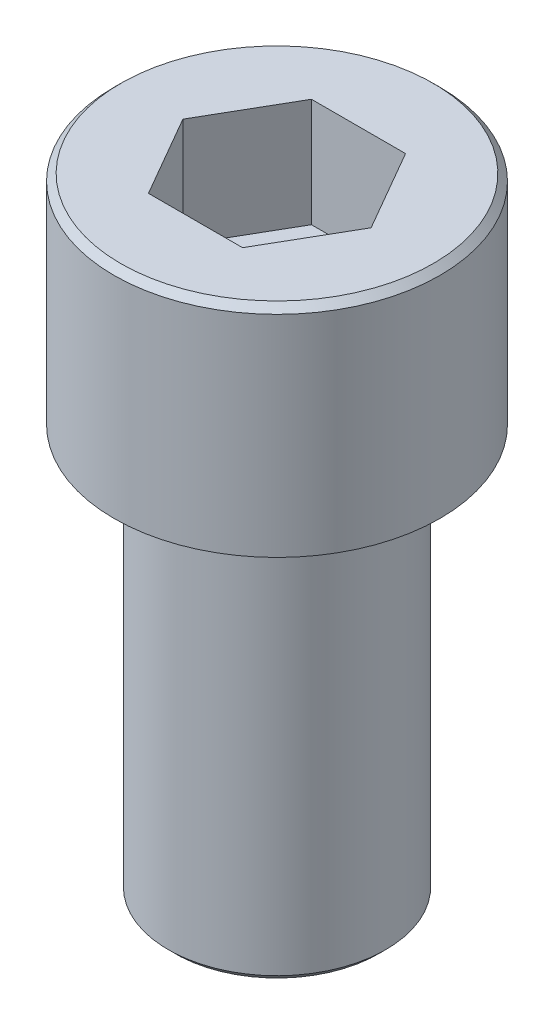
from build123d import *

# Parameters (mm, degrees)
CUT_EXTRUDE1_DEPTH = 8
CHAMFER1_SIZE      = 0.5
CUT_EXTRUDE2_DEPTH = 0.1


with BuildPart() as part:
    # Sketch1 → Base-Revolve (revolve)
    with BuildSketch(Plane.XY, mode=Mode.PRIVATE) as base_revolve_sk:
        Polygon((0, 0), (8, 0), (8, 30), (12, 30), (12, 46), (0, 46), align=None)
    revolve(base_revolve_sk.sketch.rotate(Axis((0, 0, 0), (0, 1, 0)), 90), axis=Axis((0, 0, 0), (0, 1, 0)))

    # Sketch2 → Cut-Extrude1 (cut)
    with BuildSketch(Plane(origin=(0, 46, 0), x_dir=(-1, 0, 0), z_dir=(0, 1, 0))):
        Polygon((3.464101615, -6), (-3.464101615, -6), (-6.92820323, 0), (-3.464101615, 6), (3.464101615, 6), (6.92820323, 0), align=None)
    extrude(amount=-CUT_EXTRUDE1_DEPTH, mode=Mode.SUBTRACT)

    # Chamfer1
    chamfer1_edges = [part.edges().sort_by_distance(p)[0] for p in [
        (0, 46, 12),
        (0, 0, 8),
    ]]
    chamfer(chamfer1_edges, length=CHAMFER1_SIZE)

    # Sketch3 → Cut-Extrude2 (cut)
    # profile 1 of 4: a face of its own
    with BuildSketch(Plane(origin=(0, 38, 0), x_dir=(1, 0, 0), z_dir=(0, 1, 0))):
        Polygon((-3.202624199, -0.5), (-2.740384615, -0.5), (-2.740384615, -3), (-2.96474359, -3), (-2.96474359, -0.756410256), (-3.349358974, -0.756410256), align=None)
    # profile 2 of 4: a face of its own
    with BuildSketch(Plane(origin=(0, 38, 0), x_dir=(1, 0, 0), z_dir=(0, 1, 0))):
        with BuildLine():
            Line((-1.490384615, -1.269230769), (-1.71474359, -1.269230769))
            add(Edge.make_bspline(
                [(-1.71474359, -1.269230769), (-1.713281338, -1.239465849), (-1.710409513, -1.181008339), (-1.696960735, -1.095776977), (-1.677717252, -1.014309264), (-1.65050907, -0.937259325), (-1.616718872, -0.863945892), (-1.576197424, -0.794660166), (-1.528201816, -0.72966646), (-1.473768435, -0.669567286), (-1.414647978, -0.614433307), (-1.350858021, -0.566822419), (-1.283825859, -0.526595511), (-1.21375486, -0.492966053), (-1.139854457, -0.467723306), (-1.062795273, -0.448993563), (-0.982238747, -0.437724745), (-0.927353017, -0.436513469), (-0.899439103, -0.435897436)],
                knots=[0, 0, 0, 0, 1.10065271, 2.161652631, 3.183658789, 4.190468796, 5.17591951, 6.163126047, 7.15150782, 8.156236427, 9.156009102, 10.134482811, 11.092018607, 12.041330605, 13.001268258, 13.972401359, 14.968799086, 16, 16, 16, 16], degree=3))
            add(Edge.make_bspline(
                [(-0.899439103, -0.435897436), (-0.872026193, -0.436539191), (-0.818160803, -0.437800215), (-0.739545079, -0.448629522), (-0.664704154, -0.465590659), (-0.593784321, -0.489387385), (-0.527351418, -0.521376262), (-0.464906386, -0.559803075), (-0.405705807, -0.604245812), (-0.352415247, -0.656569964), (-0.303480905, -0.71242881), (-0.261265008, -0.772063027), (-0.225112749, -0.833655374), (-0.194978692, -0.897675518), (-0.172795735, -0.964726252), (-0.155954158, -1.033831397), (-0.146434577, -1.105706262), (-0.14497356, -1.154353802), (-0.144230769, -1.179086538)],
                knots=[0, 0, 0, 0, 1.111607364, 2.184268762, 3.212621178, 4.221274766, 5.211760367, 6.196651075, 7.1921475, 8.207485113, 9.220403448, 10.201281604, 11.166441695, 12.114753415, 13.065576456, 14.026450734, 14.996634279, 16, 16, 16, 16], degree=3))
            add(Edge.make_bspline(
                [(-0.144230769, -1.179086538), (-0.145435516, -1.213907831), (-0.147823867, -1.282939351), (-0.168435083, -1.384513892), (-0.200279438, -1.483017506), (-0.23890303, -1.562288257), (-0.277917721, -1.625843181), (-0.312331861, -1.678640068), (-0.353512113, -1.734944651), (-0.401081694, -1.795324014), (-0.454322984, -1.85996285), (-0.513619176, -1.928887683), (-0.57942324, -2.001366472), (-0.625607656, -2.050870625), (-0.649539263, -2.076522436)],
                knots=[0, 0, 0, 0, 1.184203166, 2.347625244, 3.513805382, 4.700623107, 5.337941753, 6.051866363, 6.845199593, 7.711357327, 8.668078039, 9.695487809, 10.805859518, 12, 12, 12, 12], degree=3))
            Line((-0.649539263, -2.076522436), (-1.275040064, -2.743589744))
            Line((-1.275040064, -2.743589744), (-0.112179487, -2.743589744))
            Line((-0.112179487, -2.743589744), (-0.112179487, -3))
            Line((-0.112179487, -3), (-1.810897436, -3))
            Line((-1.810897436, -3), (-0.841346154, -1.965344551))
            add(Edge.make_bspline(
                [(-0.841346154, -1.965344551), (-0.81774052, -1.940702904), (-0.77239893, -1.893371342), (-0.708268518, -1.824269228), (-0.65066924, -1.760162413), (-0.599228245, -1.701172021), (-0.555061456, -1.646435187), (-0.515867004, -1.597724684), (-0.484463011, -1.552900077), (-0.450380585, -1.500942496), (-0.417370599, -1.437505126), (-0.38900463, -1.359981062), (-0.37170831, -1.280175882), (-0.369633427, -1.226245855), (-0.368589744, -1.19911859)],
                knots=[0, 0, 0, 0, 1.329631726, 2.553950428, 3.673215718, 4.687767853, 5.603093632, 6.413772471, 7.123043292, 7.734684054, 8.834405432, 9.900288307, 10.943827018, 12, 12, 12, 12], degree=3))
            add(Edge.make_bspline(
                [(-0.368589744, -1.19911859), (-0.369043845, -1.182060448), (-0.369938792, -1.148442126), (-0.377837148, -1.099152298), (-0.389773224, -1.051606003), (-0.406876979, -1.005656989), (-0.429453222, -0.961767238), (-0.456934208, -0.919883323), (-0.488641396, -0.879391205), (-0.525320874, -0.841424564), (-0.565614817, -0.806652274), (-0.608182138, -0.775849356), (-0.653217927, -0.750107134), (-0.7005323, -0.729004636), (-0.749993349, -0.712450792), (-0.801696739, -0.700980378), (-0.855499607, -0.693778604), (-0.892237819, -0.692804196), (-0.910957532, -0.692307692)],
                knots=[0, 0, 0, 0, 0.991446411, 1.95395049, 2.89581595, 3.838931463, 4.798493298, 5.75982156, 6.748411868, 7.785213223, 8.824556874, 9.840280684, 10.836137867, 11.835679398, 12.848801643, 13.863922112, 14.911575587, 16, 16, 16, 16], degree=3))
            add(Edge.make_bspline(
                [(-0.910957532, -0.692307692), (-0.930508127, -0.69281843), (-0.968902267, -0.693821433), (-1.025273005, -0.700837622), (-1.07904856, -0.712941794), (-1.130364205, -0.729496561), (-1.179306766, -0.750538382), (-1.225638227, -0.776746771), (-1.269254576, -0.808020694), (-1.310237807, -0.843478235), (-1.347997792, -0.882955093), (-1.381174132, -0.926962209), (-1.410162713, -0.974696077), (-1.435455023, -1.026027899), (-1.455994802, -1.081423456), (-1.471689909, -1.140686103), (-1.484109085, -1.203558518), (-1.488258029, -1.246976436), (-1.490384615, -1.269230769)],
                knots=[0, 0, 0, 0, 1.031018746, 2.02475058, 2.990194455, 3.934040569, 4.864654155, 5.795059489, 6.735614925, 7.690564532, 8.649604399, 9.611025574, 10.590972636, 11.591080095, 12.624614302, 13.701020113, 14.821632451, 16, 16, 16, 16], degree=3))
        make_face()
    # profile 3 of 4: a face of its own
    with BuildSketch(Plane(origin=(0, 38, 0), x_dir=(1, 0, 0), z_dir=(0, 1, 0))):
        with BuildLine():
            add(Edge.make_bspline(
                [(0.512820513, -2.615384615), (0.526742093, -2.616211877), (0.554033723, -2.617833628), (0.593490243, -2.628959823), (0.629200715, -2.648716009), (0.661009461, -2.675046565), (0.687228373, -2.706972039), (0.707688624, -2.742397688), (0.718717899, -2.78218454), (0.720327836, -2.809634308), (0.721153846, -2.823717949)],
                knots=[0, 0, 0, 0, 1.020151414, 1.999887582, 2.974338812, 3.990962822, 5.007586832, 5.987933904, 6.967670073, 8, 8, 8, 8], degree=3))
            add(Edge.make_bspline(
                [(0.721153846, -2.823717949), (0.720299846, -2.837463184), (0.718615769, -2.864568587), (0.707713906, -2.904055346), (0.687072442, -2.939503135), (0.661190304, -2.971861805), (0.629192851, -2.998248141), (0.593405818, -3.017836244), (0.554126348, -3.029759087), (0.526757546, -3.031277871), (0.512820513, -3.032051282)],
                knots=[0, 0, 0, 0, 1.009421747, 1.99056486, 2.972319754, 3.999869655, 5.017953583, 5.993804169, 6.978383603, 8, 8, 8, 8], degree=3))
            add(Edge.make_bspline(
                [(0.512820513, -3.032051282), (0.498873437, -3.031305855), (0.471645093, -3.029850588), (0.43251224, -3.01759144), (0.396507262, -2.998431826), (0.364516039, -2.971812605), (0.338417131, -2.939669645), (0.318684715, -2.903811219), (0.306834608, -2.864681621), (0.305276128, -2.837485448), (0.304487179, -2.823717949)],
                knots=[0, 0, 0, 0, 1.022052826, 1.995314843, 2.982371812, 4.00089066, 5.028879526, 6.005146991, 6.990147033, 8, 8, 8, 8], degree=3))
            add(Edge.make_bspline(
                [(0.304487179, -2.823717949), (0.305245822, -2.809611249), (0.306726978, -2.782069649), (0.318709592, -2.742641715), (0.338264029, -2.706807116), (0.364696454, -2.675095273), (0.396499523, -2.648532914), (0.432425384, -2.629200919), (0.471739341, -2.617743481), (0.498889297, -2.616184541), (0.512820513, -2.615384615)],
                knots=[0, 0, 0, 0, 1.032775665, 2.016367738, 2.991239715, 4.008302682, 5.025365648, 6.011011707, 6.979408107, 8, 8, 8, 8], degree=3))
        make_face()
    # profile 4 of 4: a face of its own
    with BuildSketch(Plane(origin=(0, 38, 0), x_dir=(1, 0, 0), z_dir=(0, 1, 0))):
        with BuildLine():
            Line((1.586538462, -3.064102564), (1.407251603, -2.939403045))
            Line((1.407251603, -2.939403045), (2.102363782, -1.923277244))
            add(Edge.make_bspline(
                [(2.102363782, -1.923277244), (2.058013257, -1.92870086), (1.970684599, -1.939380264), (1.882729526, -1.94134216), (1.839443109, -1.942307692)],
                knots=[0, 0, 0, 0, 1.015715272, 2, 2, 2, 2], degree=3))
            add(Edge.make_bspline(
                [(1.839443109, -1.942307692), (1.813198789, -1.941635495), (1.761683484, -1.94031603), (1.68594659, -1.929857595), (1.613171189, -1.913750361), (1.543550221, -1.889715536), (1.476822003, -1.859845387), (1.413132208, -1.822804663), (1.352566572, -1.77922874), (1.295775564, -1.729348032), (1.244124322, -1.674577995), (1.198107681, -1.616609678), (1.159864015, -1.554769699), (1.128095026, -1.490319542), (1.104001845, -1.422332863), (1.086457175, -1.351583292), (1.075655493, -1.277574976), (1.074370425, -1.227199883), (1.073717949, -1.201622596)],
                knots=[0, 0, 0, 0, 1.060718605, 2.082097864, 3.085795603, 4.069760067, 5.054557537, 6.03741023, 7.043284206, 8.066802108, 9.088538119, 10.083643548, 11.053783639, 12.022749082, 12.983451788, 13.964007469, 14.966251758, 16, 16, 16, 16], degree=3))
            add(Edge.make_bspline(
                [(1.073717949, -1.201622596), (1.074956831, -1.166644987), (1.077388505, -1.097991036), (1.096958874, -0.997681201), (1.129144831, -0.90283367), (1.174022243, -0.813697817), (1.230547044, -0.73155586), (1.298481751, -0.657549711), (1.377413154, -0.592731958), (1.465543168, -0.53701476), (1.560795325, -0.492204048), (1.660558653, -0.459175976), (1.764068738, -0.439748299), (1.834188503, -0.43718697), (1.869491186, -0.435897436)],
                knots=[0, 0, 0, 0, 1.022988612, 2.007919123, 2.978103895, 3.94594894, 4.918897164, 5.887013414, 6.875921846, 7.89917871, 8.930658928, 9.948724884, 10.967259574, 12, 12, 12, 12], degree=3))
            add(Edge.make_bspline(
                [(1.869491186, -0.435897436), (1.904125771, -0.437204695), (1.972560448, -0.439787716), (2.073195452, -0.458704837), (2.169581893, -0.490588175), (2.261185455, -0.534648578), (2.345999321, -0.589877797), (2.422267757, -0.655688171), (2.488250285, -0.732120691), (2.543838772, -0.817326755), (2.588460229, -0.908874599), (2.620654717, -1.004434544), (2.64047303, -1.103319345), (2.642970407, -1.170315397), (2.644230769, -1.204126603)],
                knots=[0, 0, 0, 0, 1.026385292, 2.028040595, 3.023318987, 4.028184125, 5.03290303, 6.015178782, 7.004435299, 8.016004309, 9.023023918, 10.015172535, 10.998308025, 12, 12, 12, 12], degree=3))
            add(Edge.make_bspline(
                [(2.644230769, -1.204126603), (2.643389049, -1.230372151), (2.641681829, -1.28360468), (2.629727324, -1.364483496), (2.609427191, -1.44694866), (2.586390264, -1.5167498), (2.564153001, -1.574398692), (2.543223621, -1.619935535), (2.520000655, -1.667865009), (2.492915822, -1.717684536), (2.463799896, -1.770029204), (2.430900413, -1.824374001), (2.394967861, -1.880791853), (2.369375204, -1.918825487), (2.356270032, -1.938301282)],
                knots=[0, 0, 0, 0, 1.179839688, 2.393009684, 3.667231171, 4.993948276, 5.694988576, 6.444077775, 7.246288328, 8.089075292, 8.993003841, 9.939041771, 10.944649915, 12, 12, 12, 12], degree=3))
            Line((2.356270032, -1.938301282), (1.586538462, -3.064102564))
        make_face()
        with BuildLine():
            add(Edge.make_bspline(
                [(1.881009615, -1.685897436), (1.900891054, -1.685354305), (1.939593456, -1.684297013), (1.996291527, -1.67786184), (2.049808815, -1.66645185), (2.100288279, -1.650080627), (2.148236066, -1.630325863), (2.192890586, -1.605174445), (2.234289211, -1.575162563), (2.272709159, -1.541441123), (2.306826302, -1.50397642), (2.337214181, -1.464764201), (2.363043158, -1.423632337), (2.383445498, -1.380065721), (2.400220195, -1.335124858), (2.41180449, -1.288086033), (2.41822187, -1.239194318), (2.419315852, -1.205980991), (2.419871795, -1.189102564)],
                knots=[0, 0, 0, 0, 1.163407946, 2.26475976, 3.333800367, 4.359385343, 5.366239384, 6.363380779, 7.350133999, 8.353570782, 9.349036268, 10.310270964, 11.253520213, 12.184142, 13.120487599, 14.056272588, 15.012232024, 16, 16, 16, 16], degree=3))
            add(Edge.make_bspline(
                [(2.419871795, -1.189102564), (2.41939346, -1.172217089), (2.418450842, -1.138942189), (2.410888485, -1.089978089), (2.397584754, -1.043054331), (2.379734408, -0.997914024), (2.356219952, -0.954928044), (2.328003177, -0.913556707), (2.294479998, -0.87406233), (2.255906737, -0.837373771), (2.214310627, -0.803553843), (2.169981699, -0.773706645), (2.12328533, -0.748691505), (2.074506409, -0.728049384), (2.023543302, -0.711940973), (1.970426168, -0.700357141), (1.914886593, -0.693948745), (1.877185674, -0.692861677), (1.857972756, -0.692307692)],
                knots=[0, 0, 0, 0, 0.972161553, 1.915763587, 2.844109794, 3.775983486, 4.705125789, 5.659731448, 6.655561913, 7.682237399, 8.721216875, 9.739758359, 10.754845918, 11.767244016, 12.7857855, 13.828538656, 14.893392813, 16, 16, 16, 16], degree=3))
            add(Edge.make_bspline(
                [(1.857972756, -0.692307692), (1.838926933, -0.692862572), (1.801559183, -0.693951242), (1.746513355, -0.70034496), (1.693755378, -0.712018877), (1.642939935, -0.728041922), (1.594162463, -0.748693045), (1.547468297, -0.773707956), (1.503128999, -0.803546972), (1.46157277, -0.837400381), (1.422931397, -0.873891557), (1.389984591, -0.91372972), (1.361703239, -0.954906524), (1.338221094, -0.997919744), (1.320362153, -1.043052805), (1.307060724, -1.089978503), (1.299497748, -1.138942081), (1.298555215, -1.172217053), (1.298076923, -1.189102564)],
                knots=[0, 0, 0, 0, 1.099389452, 2.15699305, 3.192601482, 4.213358962, 5.227959689, 6.245255729, 7.266013209, 8.307253147, 9.336162325, 10.327954924, 11.284637477, 12.215801273, 13.149702402, 14.080068371, 15.025723358, 16, 16, 16, 16], degree=3))
            add(Edge.make_bspline(
                [(1.298076923, -1.189102564), (1.298509727, -1.205994135), (1.299363297, -1.239307403), (1.307597432, -1.288254827), (1.321367632, -1.335174965), (1.339810054, -1.380524042), (1.364096904, -1.423861083), (1.393899653, -1.464980628), (1.428832186, -1.504348806), (1.468427534, -1.541353958), (1.511761935, -1.575319797), (1.558045325, -1.604984356), (1.606480923, -1.630036102), (1.65723923, -1.65013709), (1.709944087, -1.666288279), (1.765069181, -1.677840811), (1.822432208, -1.684235287), (1.861296481, -1.685338071), (1.881009615, -1.685897436)],
                knots=[0, 0, 0, 0, 0.952633368, 1.87876736, 2.791047057, 3.707742249, 4.635551637, 5.587206343, 6.568248508, 7.601284464, 8.641511608, 9.671105535, 10.699146789, 11.713763218, 12.747829548, 13.806491675, 14.887386225, 16, 16, 16, 16], degree=3))
        make_face(mode=Mode.SUBTRACT)
    extrude(amount=-CUT_EXTRUDE2_DEPTH, mode=Mode.SUBTRACT)


solid = part.part
